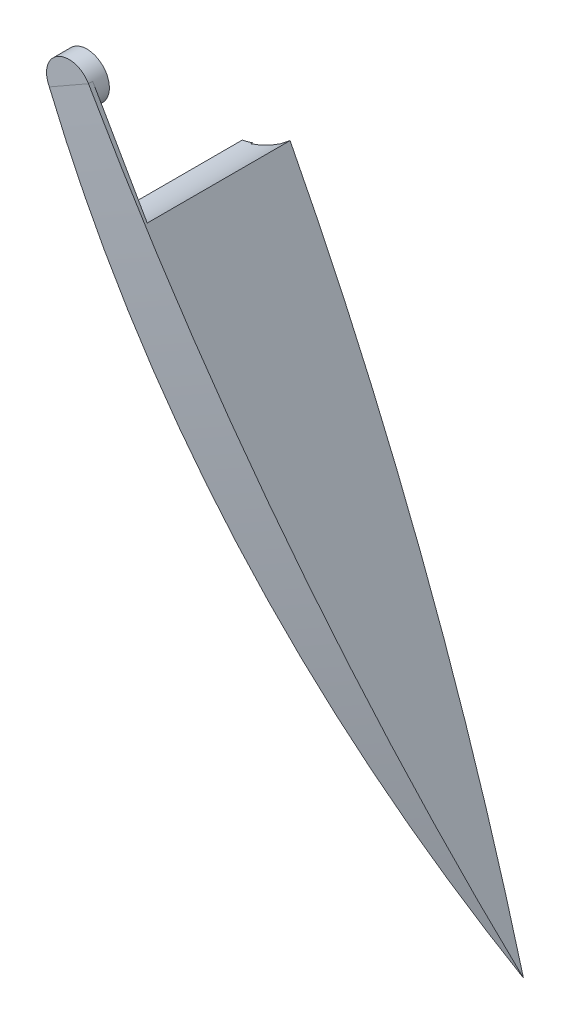
from build123d import *

# Parameters (mm, degrees)
ESQUISSE1_R             = 8
BOSS_EXTRU_1_DEPTH      = 4.9
BOSS_EXTRU_2_START      = 1.5
BOSS_EXTRU_2_DEPTH      = 1.5
BOSS_EXTRU_3_DEPTH      = 51.5
ENL_V_MAT_EXTRU_1_DEPTH = 25


with BuildPart() as part:
    # Esquisse1 → Boss.-Extru.1 (new body)
    with BuildSketch(Plane.XY):
        with Locations((-10.25, -10)):
            Circle(ESQUISSE1_R)
        with BuildLine():
            Line((-5.751675839, -9.877200395), (-6.833750507, -9.782531128))
            Line((-6.833750507, -9.782531128), (-6.949445107, -9.126394451))
            Line((-6.949445107, -9.126394451), (-5.953521963, -8.661987862))
            ThreePointArc((-5.953521963, -8.661987862), (-6.006634107, -8.502052772), (-6.065697468, -8.344218516))
            Line((-6.065697468, -8.344218516), (-7.138261768, -8.631611254))
            Line((-7.138261768, -8.631611254), (-7.47139109, -8.054614344))
            Line((-7.47139109, -8.054614344), (-6.678798898, -7.262022153))
            ThreePointArc((-6.678798898, -7.262022153), (-6.782621037, -7.131675902), (-6.891198054, -7.005263035))
            Line((-6.891198054, -7.005263035), (-7.818046533, -7.654249327))
            Line((-7.818046533, -7.654249327), (-8.328430264, -7.225986526))
            Line((-8.328430264, -7.225986526), (-7.847635402, -6.194918616))
            ThreePointArc((-7.847635402, -6.194918616), (-7.988951343, -6.109285545), (-8.133315872, -6.028898352))
            Line((-8.133315872, -6.028898352), (-8.791112727, -6.968329619))
            Line((-8.791112727, -6.968329619), (-9.417191057, -6.740455742))
            Line((-9.417191057, -6.740455742), (-9.317216173, -5.597737589))
            ThreePointArc((-9.317216173, -5.597737589), (-9.478728542, -5.566588183), (-9.641271425, -5.541362369))
            Line((-9.641271425, -5.541362369), (-9.940094206, -6.656584169))
            Line((-9.940094206, -6.656584169), (-10.606352849, -6.656584169))
            Line((-10.606352849, -6.656584169), (-10.903477232, -5.547700874))
            ThreePointArc((-10.903477232, -5.547700874), (-11.065761738, -5.574558464), (-11.226956242, -5.607329229))
            Line((-11.226956242, -5.607329229), (-11.126406846, -6.756614081))
            Line((-11.126406846, -6.756614081), (-11.752485176, -6.984487958))
            Line((-11.752485176, -6.984487958), (-12.406540122, -6.050400691))
            ThreePointArc((-12.406540122, -6.050400691), (-12.550096477, -6.132241451), (-12.690551241, -6.219297732))
            Line((-12.690551241, -6.219297732), (-12.206963835, -7.256354271))
            Line((-12.206963835, -7.256354271), (-12.717347566, -7.684617071))
            Line((-12.717347566, -7.684617071), (-13.638885709, -7.039349117))
            ThreePointArc((-13.638885709, -7.039349117), (-13.74618945, -7.166864047), (-13.848697947, -7.298264801))
            Line((-13.848697947, -7.298264801), (-13.051434053, -8.095528695))
            Line((-13.051434053, -8.095528695), (-13.384563375, -8.672525605))
            Line((-13.384563375, -8.672525605), (-14.450903238, -8.3868007))
            ThreePointArc((-14.450903238, -8.3868007), (-14.508366703, -8.545244687), (-14.559856563, -8.705729393))
            Line((-14.559856563, -8.705729393), (-13.557961929, -9.172920534))
            Line((-13.557961929, -9.172920534), (-13.673656528, -9.829057211))
            Line((-13.673656528, -9.829057211), (-14.74934404, -9.923167674))
            ThreePointArc((-14.74934404, -9.923167674), (-14.749021481, -10.093838761), (-14.74222728, -10.264374865))
            Line((-14.74222728, -10.264374865), (-13.665452724, -10.358580432))
            Line((-13.665452724, -10.358580432), (-13.549758125, -11.014717109))
            Line((-13.549758125, -11.014717109), (-14.506309194, -11.460764198))
            ThreePointArc((-14.506309194, -11.460764198), (-14.447094307, -11.623083293), (-14.381691786, -11.78300953))
            Line((-14.381691786, -11.78300953), (-13.360941463, -11.509500306))
            Line((-13.360941463, -11.509500306), (-13.027812142, -12.086497216))
            Line((-13.027812142, -12.086497216), (-13.758807936, -12.817493011))
            ThreePointArc((-13.758807936, -12.817493011), (-13.646852578, -12.951506829), (-13.529782028, -13.081076086))
            Line((-13.529782028, -13.081076086), (-12.681156698, -12.486862233))
            Line((-12.681156698, -12.486862233), (-12.170772967, -12.915125033))
            Line((-12.170772967, -12.915125033), (-12.600738895, -13.837189942))
            ThreePointArc((-12.600738895, -13.837189942), (-12.448909121, -13.926168447), (-12.293716433, -14.009142444))
            Line((-12.293716433, -14.009142444), (-11.708090504, -13.172781941))
            Line((-11.708090504, -13.172781941), (-11.082012174, -13.400655818))
            Line((-11.082012174, -13.400655818), (-11.169878896, -14.404977051))
            ThreePointArc((-11.169878896, -14.404977051), (-10.996236031, -14.437694422), (-10.821442589, -14.463569577))
            Line((-10.821442589, -14.463569577), (-10.559109026, -13.48452739))
            Line((-10.559109026, -13.48452739), (-9.892850383, -13.48452739))
            Line((-9.892850383, -13.48452739), (-9.632173683, -14.457386077))
            ThreePointArc((-9.632173683, -14.457386077), (-9.45766281, -14.42969545), (-9.284373537, -14.395175256))
            Line((-9.284373537, -14.395175256), (-9.372796385, -13.384497479))
            Line((-9.372796385, -13.384497479), (-8.746718055, -13.156623602))
            Line((-8.746718055, -13.156623602), (-8.164782025, -13.987714383))
            ThreePointArc((-8.164782025, -13.987714383), (-8.010469052, -13.903139907), (-7.859580663, -13.812596936))
            Line((-7.859580663, -13.812596936), (-8.292239396, -12.884757289))
            Line((-8.292239396, -12.884757289), (-7.781855665, -12.456494489))
            Line((-7.781855665, -12.456494489), (-6.938532496, -13.046995729))
            ThreePointArc((-6.938532496, -13.046995729), (-6.822819391, -12.916236114), (-6.712266113, -12.78108593))
            Line((-6.712266113, -12.78108593), (-7.447769178, -12.045582865))
            Line((-7.447769178, -12.045582865), (-7.114639857, -11.468585954))
            Line((-7.114639857, -11.468585954), (-6.100183444, -11.740408731))
            ThreePointArc((-6.100183444, -11.740408731), (-6.036436962, -11.579837499), (-5.978900904, -11.416937723))
            Line((-5.978900904, -11.416937723), (-6.941241303, -10.968191026))
            Line((-6.941241303, -10.968191026), (-6.825546704, -10.312054348))
            Line((-6.825546704, -10.312054348), (-5.755303948, -10.21842024))
            ThreePointArc((-5.755303948, -10.21842024), (-5.750254354, -10.04784472), (-5.751675839, -9.877200395))
        make_face(mode=Mode.SUBTRACT)
    extrude(amount=-BOSS_EXTRU_1_DEPTH)

    # Esquisse2 → Boss.-Extru.2 (add)
    with BuildSketch(Plane.XY.offset(BOSS_EXTRU_2_START)):
        with BuildLine():
            ThreePointArc((-3.303360096, -6.032104583), (-13.772784459, -2.817382813), (-17.640109889, -13.06370296))
            Line((-17.640109889, -13.06370296), (-17.639263276, -13.065744321))
            ThreePointArc((-17.639263276, -13.065744321), (43.56377057, -128.719994734), (125.190682292, -230.988094713))
            Line((125.190682292, -230.988094713), (-3.303360096, -6.032104583))
        make_face()
    extrude(amount=-BOSS_EXTRU_2_DEPTH)

    # Esquisse3 → Boss.-Extru.3 (add)
    with BuildSketch(Plane(origin=(0, 0, 0), x_dir=(-1, 0, 0), z_dir=(0, 0, -1))):
        with BuildLine():
            Line((-16.135278154, -40.063550967), (-125.190682292, -230.988094713))
            ThreePointArc((-125.190682292, -230.988094713), (-54.599179759, -145.051819269), (1.516379631, -49.034905857))
            ThreePointArc((1.516379631, -49.034905857), (-7.873342973, -45.658721787), (-16.135278154, -40.063550967))
        make_face()
    extrude(amount=BOSS_EXTRU_3_DEPTH)

    # Esquisse4 → Enlèv. mat.-Extru.1 (cut)
    with BuildSketch(Plane(origin=(-5.088632244, -2.906608208, 0), x_dir=(0, 0, -1), z_dir=(0.8683299880241373, 0.4959869271442563, 0))):
        with BuildLine():
            Line((-1.5, -3.599433877), (-1.5, -262.666831333))
            Line((-1.5, -262.666831333), (25, -262.666831333))
            ThreePointArc((25, -262.666831333), (5.142239669, -133.809040305), (-1.5, -3.599433877))
        make_face()
        with BuildLine():
            ThreePointArc((50.899666007, -42.791269762), (42.714152109, -153.29025104), (25, -262.666831333))
            Line((25, -262.666831333), (51.5, -262.666831333))
            Line((51.5, -262.666831333), (51.5, -42.791269762))
            Line((51.5, -42.791269762), (50.899666007, -42.791269762))
        make_face()
    extrude(amount=-ENL_V_MAT_EXTRU_1_DEPTH, mode=Mode.SUBTRACT)


solid = part.part
